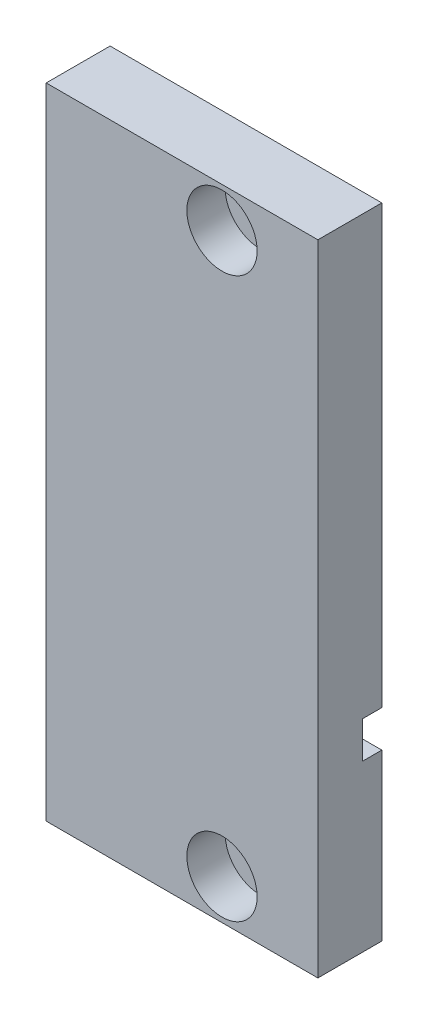
from build123d import *

# Parameters (mm, degrees)
ESQUISSE1_W                                       = 17
ESQUISSE1_H                                       = 40
BOSS_EXTRU_1_DEPTH                                = 4
CHAMBRAGE_POUR_VIS_SIX_PANS_CREUX_M21_D           = 2.4
CHAMBRAGE_POUR_VIS_SIX_PANS_CREUX_M21_CBORE_D     = 4.4
CHAMBRAGE_POUR_VIS_SIX_PANS_CREUX_M21_CBORE_DEPTH = 2.4
ESQUISSE7_W                                       = 12
ESQUISSE7_H                                       = 2.3
ESQUISSE7_W_2                                     = 2.3
ESQUISSE7_H_2                                     = 15
ENL_V_MAT_EXTRU_1_DEPTH                           = 1.2


with BuildPart() as part:
    # Esquisse1 → Boss.-Extru.1 (new body)
    with BuildSketch(Plane.XY):
        with Locations((1.5, 2.5)):
            Rectangle(ESQUISSE1_W, ESQUISSE1_H)
    extrude(amount=BOSS_EXTRU_1_DEPTH)

    # Chambrage pour vis à six pans creux M21 (through all)
    with Locations(Plane.XY.offset(4)):
        with Locations((4, -15), (4, 20)):
            CounterBoreHole(CHAMBRAGE_POUR_VIS_SIX_PANS_CREUX_M21_D / 2, CHAMBRAGE_POUR_VIS_SIX_PANS_CREUX_M21_CBORE_D / 2, CHAMBRAGE_POUR_VIS_SIX_PANS_CREUX_M21_CBORE_DEPTH)

    # Esquisse7 → Enlèv. mat.-Extru.1 (cut)
    with BuildSketch(Plane(origin=(0, 0, 0), x_dir=(-1, 0, 0), z_dir=(0, 0, -1))):
        with Locations((-4, -6)):
            Rectangle(ESQUISSE7_W, ESQUISSE7_H)
        with Locations((-4, 10)):
            Rectangle(ESQUISSE7_W_2, ESQUISSE7_H_2)
    extrude(amount=-ENL_V_MAT_EXTRU_1_DEPTH, mode=Mode.SUBTRACT)


solid = part.part
